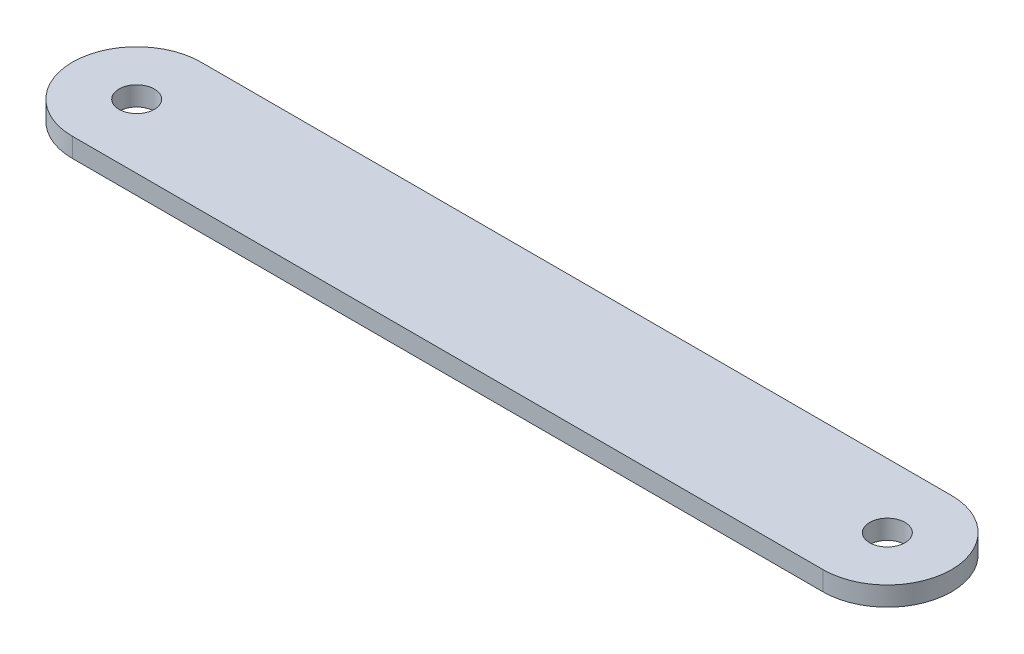
from build123d import *

# Parameters (mm, degrees)
EXTRUDE_1_DEPTH     = 3
SKETCH_2_R          = 5.5
CUT_EXTRUDE_1_DEPTH = 9


with BuildPart() as part:
    # 草图1 → 凸台-拉伸1 (new, symmetric)
    with BuildSketch(Plane(origin=(0, 0, 0), x_dir=(1, 0, 0), z_dir=(0, 1, 0))):
        with BuildLine():
            Line((116.85, -20), (-116.85, -20))
            ThreePointArc((-116.85, -20), (-136.85, 0), (-116.85, 20))
            Line((-116.85, 20), (116.85, 20))
            ThreePointArc((116.85, 20), (136.85, 0), (116.85, -20))
        make_face()
    extrude(amount=EXTRUDE_1_DEPTH, both=True)

    # 草图2 → 切除-拉伸1 (cut)
    with BuildSketch(Plane(origin=(0, 3, 0), x_dir=(1, 0, 0), z_dir=(0, 1, 0))):
        with Locations(Location((-116.85, 0, 0), (0, 0, 270))):
            Circle(SKETCH_2_R)
        with Locations(Location((116.85, 0, 0), (0, 0, 270))):
            Circle(SKETCH_2_R)
    extrude(amount=-CUT_EXTRUDE_1_DEPTH, mode=Mode.SUBTRACT)


solid = part.part
